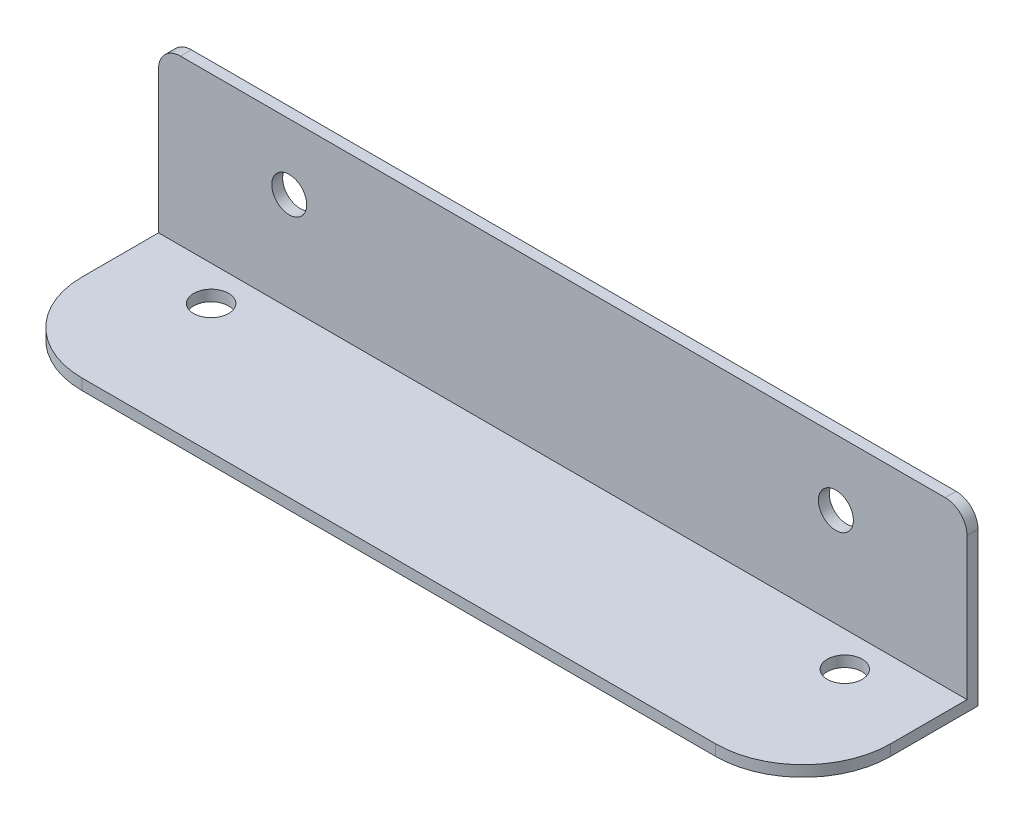
from build123d import *

# Parameters (mm, degrees)
SKETCH1_W           = 117.4
SKETCH1_H           = 25.4
BOSS_EXTRUDE1_DEPTH = 1.5875
SKETCH2_W           = 117.4
SKETCH2_H           = 1.5875
BOSS_EXTRUDE2_DEPTH = 23.8125
SKETCH3_R           = 2.54
CUT_EXTRUDE1_DEPTH  = 1.5875
SKETCH4_R           = 2.54
CUT_EXTRUDE2_DEPTH  = 1.5875
FILLET1_R           = 12.7
FILLET2_R           = 3.175


with BuildPart() as part:
    # Sketch1 → Boss-Extrude1 (new body)
    with BuildSketch(Plane.XY):
        with Locations((58.7, 0)):
            Rectangle(SKETCH1_W, SKETCH1_H)
    extrude(amount=BOSS_EXTRUDE1_DEPTH)

    # Sketch2 → Boss-Extrude2 (add)
    with BuildSketch(Plane.XY.offset(1.5875)):
        with Locations((58.7, -11.90625)):
            Rectangle(SKETCH2_W, SKETCH2_H)
    extrude(amount=BOSS_EXTRUDE2_DEPTH)

    # Sketch3 → Cut-Extrude1 (cut)
    with BuildSketch(Plane(origin=(0, -11.1125, 0), x_dir=(1, 0, 0), z_dir=(0, 1, 0))):
        with Locations(Location((12.7, -6.64845, 0), (0, 0, 270))):
            Circle(SKETCH3_R)
        with Locations(Location((104.6990032, -6.64845, 0), (0, 0, 270))):
            Circle(SKETCH3_R)
    extrude(amount=-CUT_EXTRUDE1_DEPTH, mode=Mode.SUBTRACT)

    # Sketch4 → Cut-Extrude2 (cut)
    with BuildSketch(Plane.XY.offset(1.5875)):
        with Locations((18.975, 3.175)):
            Circle(SKETCH4_R)
        with Locations((98.35, 3.175)):
            Circle(SKETCH4_R)
    extrude(amount=-CUT_EXTRUDE2_DEPTH, mode=Mode.SUBTRACT)

    # Fillet1
    fillet1_edges = [part.edges().sort_by_distance(p)[0] for p in [
        (0, -11.90625, 25.4),
        (117.4, -11.90625, 25.4),
    ]]
    fillet(fillet1_edges, radius=FILLET1_R)

    # Fillet2
    fillet2_edges = [part.edges().sort_by_distance(p)[0] for p in [
        (0, 12.7, 0.79375),
        (117.4, 12.7, 0.79375),
    ]]
    fillet(fillet2_edges, radius=FILLET2_R)


solid = part.part
